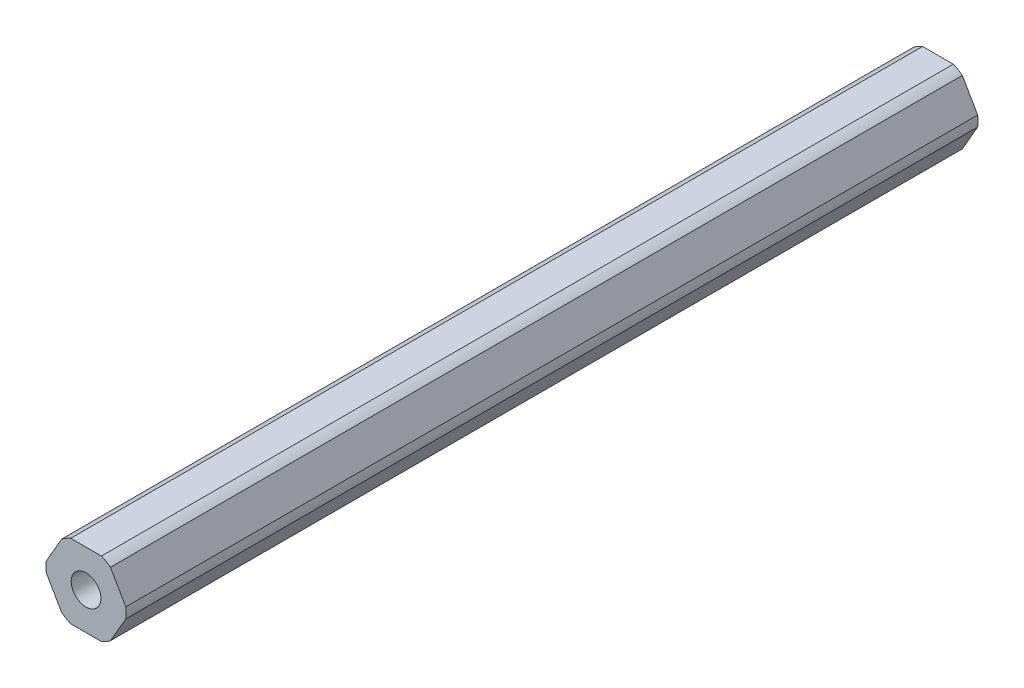
from build123d import *

# Parameters (mm, degrees)
SKETCH1_R           = 2.55
BOSS_EXTRUDE1_DEPTH = 146.05


with BuildPart() as part:
    # Sketch1 → Boss-Extrude1 (new body)
    with BuildSketch(Plane.XY):
        with BuildLine():
            Line((2.634981025, 6.35), (-2.634981025, 6.35))
            ThreePointArc((-2.634981025, 6.35), (-3.4375, 5.953924651), (-4.181770802, 5.456960506))
            Line((-4.181770802, 5.456960506), (-6.816751826, 0.893039494))
            ThreePointArc((-6.816751826, 0.893039494), (-6.875, 0), (-6.816751826, -0.893039494))
            Line((-6.816751826, -0.893039494), (-4.181770802, -5.456960506))
            ThreePointArc((-4.181770802, -5.456960506), (-3.4375, -5.953924651), (-2.634981025, -6.35))
            Line((-2.634981025, -6.35), (2.634981025, -6.35))
            ThreePointArc((2.634981025, -6.35), (3.4375, -5.953924651), (4.181770802, -5.456960506))
            Line((4.181770802, -5.456960506), (6.816751826, -0.893039494))
            ThreePointArc((6.816751826, -0.893039494), (6.875, 0), (6.816751826, 0.893039494))
            Line((6.816751826, 0.893039494), (4.181770802, 5.456960506))
            ThreePointArc((4.181770802, 5.456960506), (3.4375, 5.953924651), (2.634981025, 6.35))
        make_face()
        Circle(SKETCH1_R, mode=Mode.SUBTRACT)
    extrude(amount=BOSS_EXTRUDE1_DEPTH)


solid = part.part
